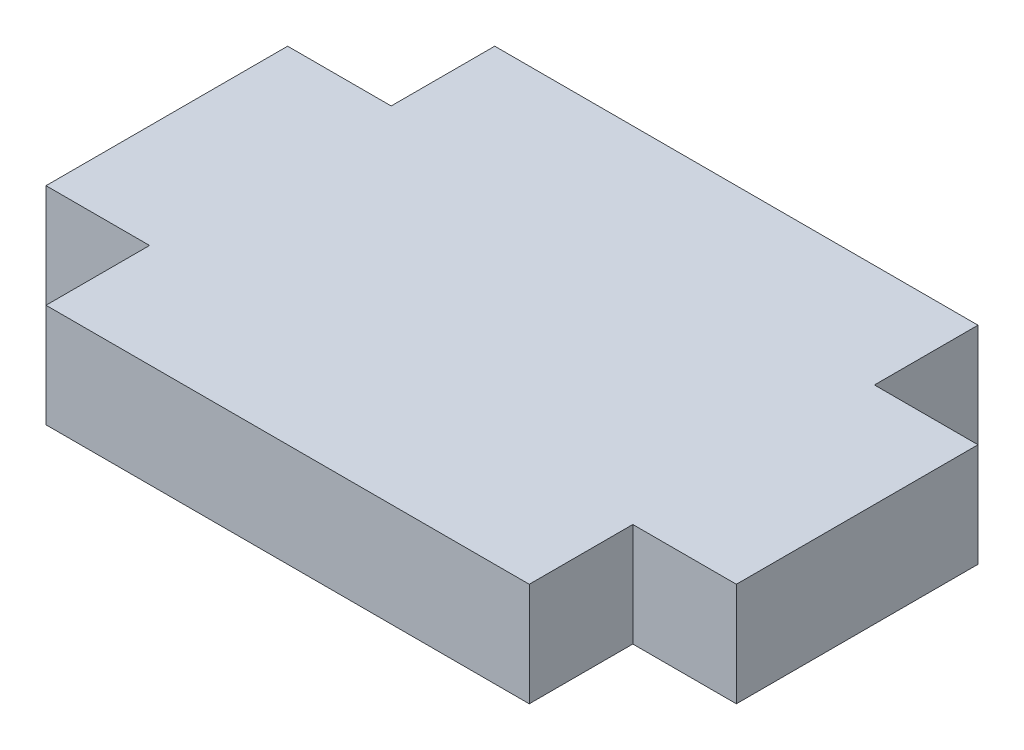
from build123d import *

# Parameters (mm, degrees)
SALIENTE_EXTRUIR1_DEPTH = 3


with BuildPart() as part:
    # Croquis1 → Saliente-Extruir1 (new body)
    with BuildSketch(Plane(origin=(0, 0, 0), x_dir=(1, 0, 0), z_dir=(0, 1, 0))):
        Polygon((0, 0), (0, 7), (3, 7), (3, 10), (17, 10), (17, 7), (20, 7), (20, 0), (17, 0), (17, -3), (3, -3), (3, 0), align=None)
    extrude(amount=SALIENTE_EXTRUIR1_DEPTH)


solid = part.part
